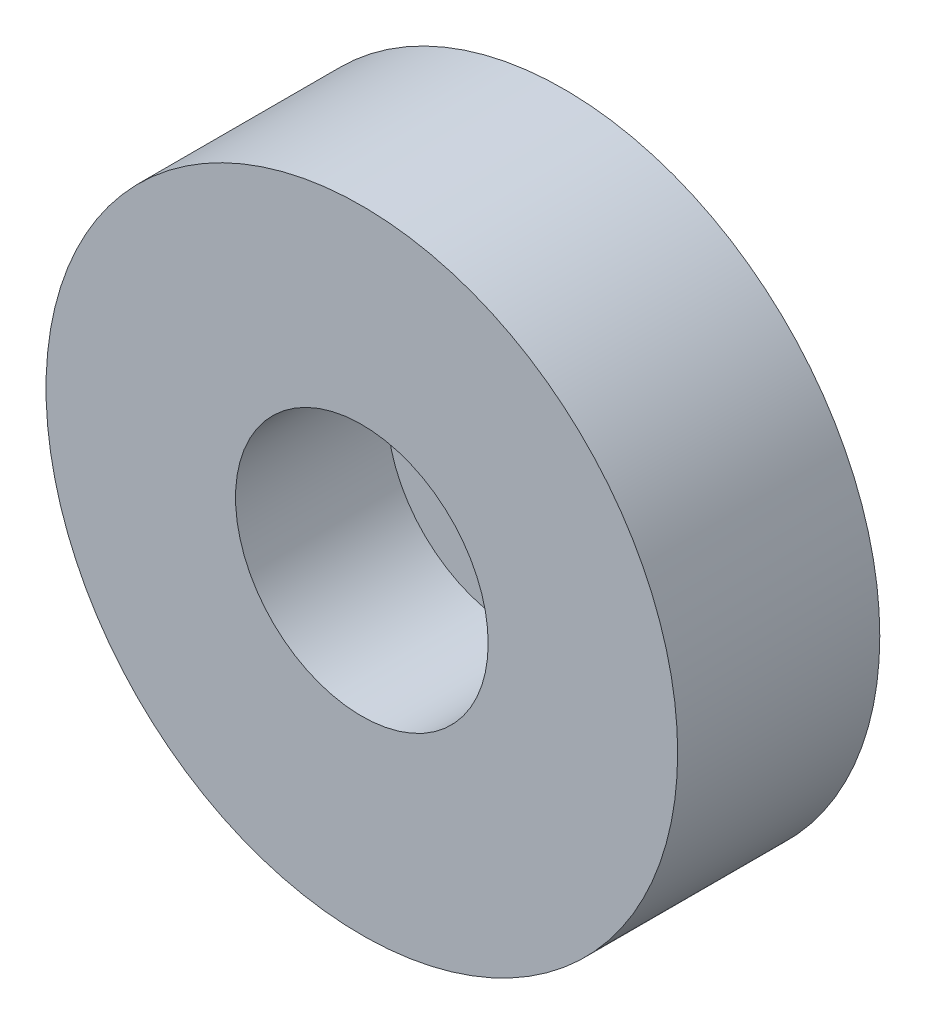
from build123d import *

# Parameters (mm, degrees)
SKETCH1_R           = 12.5
BOSS_EXTRUDE1_DEPTH = 4
SKETCH2_R           = 5
CUT_EXTRUDE1_DEPTH  = 6
SKETCH3_R           = 2.25
CUT_EXTRUDE2_DEPTH  = 2


with BuildPart() as part:
    # Sketch1 → Boss-Extrude1 (new, symmetric)
    with BuildSketch(Plane.XY):
        Circle(SKETCH1_R)
    extrude(amount=BOSS_EXTRUDE1_DEPTH, both=True)

    # Sketch2 → Cut-Extrude1 (cut)
    with BuildSketch(Plane.XY.offset(4)):
        Circle(SKETCH2_R)
    extrude(amount=-CUT_EXTRUDE1_DEPTH, mode=Mode.SUBTRACT)

    # Sketch3 → Cut-Extrude2 (cut)
    with BuildSketch(Plane.XY.offset(-2)):
        Circle(SKETCH3_R)
    extrude(amount=-CUT_EXTRUDE2_DEPTH, mode=Mode.SUBTRACT)


solid = part.part
